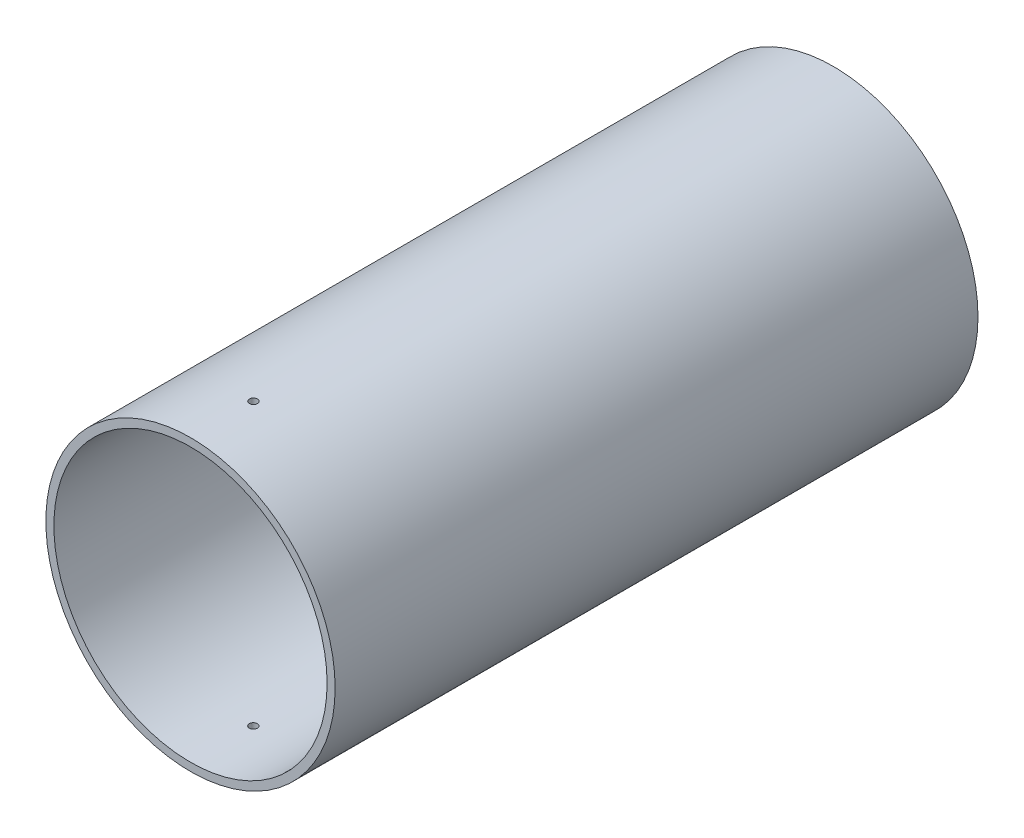
from build123d import *

# Parameters (mm, degrees)
SKETCH2_R               = 114.3
BOSS_EXTRUDE2_DEPTH     = 508
SKETCH3_R               = 107.95
CUT_EXTRUDE1_DEPTH      = 495.3
CUT_EXTRUDE2_DEPTH      = 534.09753329
CUT_EXTRUDE2_DEPTH_BACK = 534.09753329
SKETCH4_R               = 3.175


with BuildPart() as part:
    # Sketch2 → Boss-Extrude2 (new body)
    with BuildSketch(Plane.XY):
        Circle(SKETCH2_R)
    extrude(amount=BOSS_EXTRUDE2_DEPTH)

    # Sketch3 → Cut-Extrude1 (cut)
    with BuildSketch(Plane.XY.offset(508)):
        Circle(SKETCH3_R)
    extrude(amount=-CUT_EXTRUDE1_DEPTH, mode=Mode.SUBTRACT)

    # Sketch4 → Cut-Extrude2 (cut, two sides: drawn at the far end of the back side and taken through both)
    with BuildSketch(Plane(origin=(0, 0, 0), x_dir=(1, 0, 0), z_dir=(0, 1, 0)).offset(-CUT_EXTRUDE2_DEPTH_BACK)):
        with Locations(Location((0, -458.311748057, 0), (0, 0, 270))):
            Circle(SKETCH4_R)
    extrude(amount=CUT_EXTRUDE2_DEPTH + CUT_EXTRUDE2_DEPTH_BACK, mode=Mode.SUBTRACT)


solid = part.part
